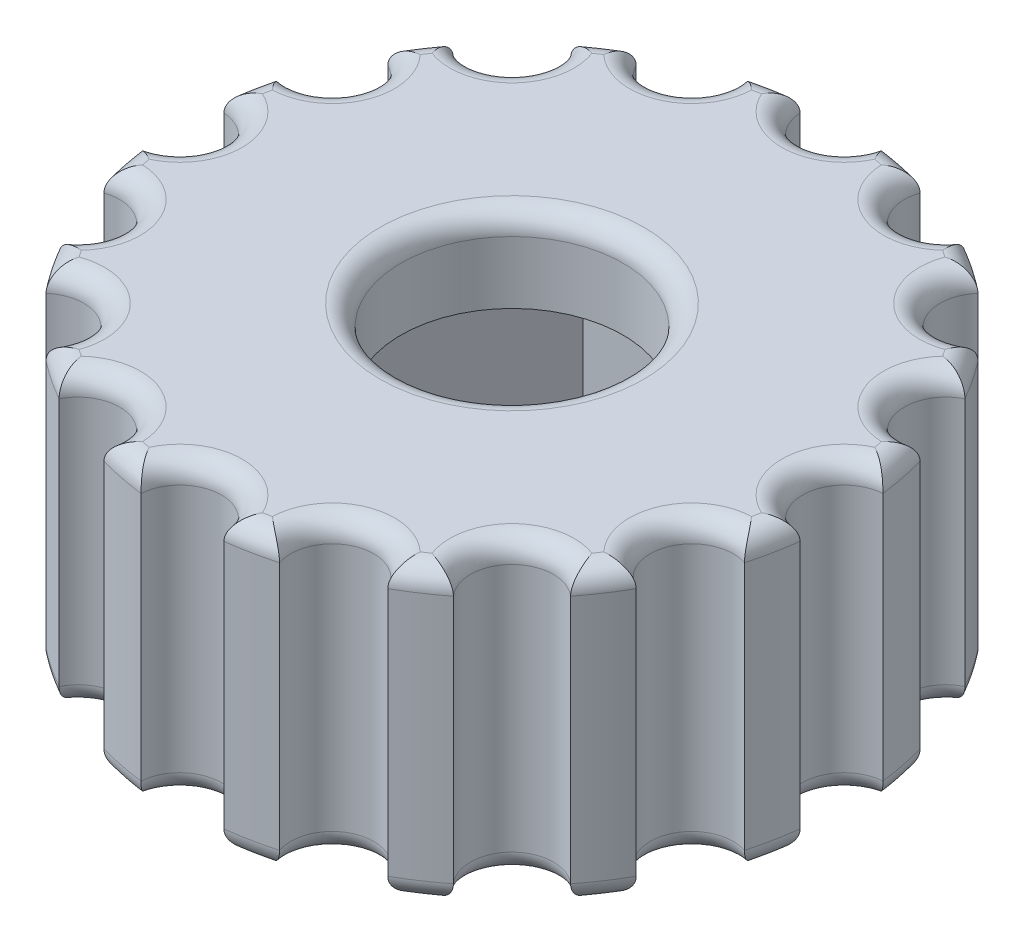
from build123d import *

# Parameters (mm, degrees)
SKETCH2_R               = 8
BOSS_EXTRUDE1_DEPTH     = 3.5
SKETCH3_R               = 8
BOSS_EXTRUDE2_DEPTH     = 2
CUT_EXTRUDE1_DEPTH      = 13.369316877
CUT_EXTRUDE1_DEPTH_BACK = 13.369316877
SKETCH4_R               = 2.675
CUT_EXTRUDE2_DEPTH      = 14.304134696
CUT_EXTRUDE2_DEPTH_BACK = 14.304134696
SKETCH5_R               = 1
FILLET1_R               = 0.5


with BuildPart() as part:
    # Sketch2 → Boss-Extrude1 (new, symmetric)
    with BuildSketch(Plane(origin=(0, 0, 0), x_dir=(1, 0, 0), z_dir=(0, 1, 0))):
        with Locations(Location((0, 0, 0), (0, 0, 270))):
            Circle(SKETCH2_R)
        Polygon((-2.3375, 4.048668763), (-4.675, 0), (-2.3375, -4.048668763), (2.3375, -4.048668763), (4.675, 0), (2.3375, 4.048668763), align=None, mode=Mode.SUBTRACT)
    extrude(amount=BOSS_EXTRUDE1_DEPTH, both=True)

    # Sketch3 → Boss-Extrude2 (add)
    with BuildSketch(Plane(origin=(0, 3.5, 0), x_dir=(1, 0, 0), z_dir=(0, 1, 0))):
        with Locations(Location((0, 0, 0), (0, 0, 270))):
            Circle(SKETCH3_R)
    extrude(amount=-BOSS_EXTRUDE2_DEPTH)

    # Sketch4 → Cut-Extrude1 (cut, two sides: drawn at the far end of the back side and taken through both)
    with BuildSketch(Plane.XZ.offset(-1.5).offset(-CUT_EXTRUDE1_DEPTH_BACK)):
        with Locations(Location((0, 0, 0), (0, 0, 270))):
            Circle(SKETCH4_R)
    extrude(amount=CUT_EXTRUDE1_DEPTH + CUT_EXTRUDE1_DEPTH_BACK, mode=Mode.SUBTRACT)

    # Sketch5 → Cut-Extrude2 (cut, two sides: drawn at the far end of the back side and taken through both)
    with BuildSketch(Plane.XZ.offset(3.5).offset(-CUT_EXTRUDE2_DEPTH_BACK)):
        with Locations((0, 8)):
            Circle(SKETCH5_R)
        with Locations((3.061467459, 7.39103626)):
            Circle(SKETCH5_R)
        with Locations((5.656854249, 5.656854249)):
            Circle(SKETCH5_R)
        with Locations((7.39103626, 3.061467459)):
            Circle(SKETCH5_R)
        with Locations((8, 0)):
            Circle(SKETCH5_R)
        with Locations((7.39103626, -3.061467459)):
            Circle(SKETCH5_R)
        with Locations((5.656854249, -5.656854249)):
            Circle(SKETCH5_R)
        with Locations((3.061467459, -7.39103626)):
            Circle(SKETCH5_R)
        with Locations((0, -8)):
            Circle(SKETCH5_R)
        with Locations((-3.061467459, -7.39103626)):
            Circle(SKETCH5_R)
        with Locations((-5.656854249, -5.656854249)):
            Circle(SKETCH5_R)
        with Locations((-7.39103626, -3.061467459)):
            Circle(SKETCH5_R)
        with Locations((-8, 0)):
            Circle(SKETCH5_R)
        with Locations((-7.39103626, 3.061467459)):
            Circle(SKETCH5_R)
        with Locations((-5.656854249, 5.656854249)):
            Circle(SKETCH5_R)
        with Locations((-3.061467459, 7.39103626)):
            Circle(SKETCH5_R)
    extrude(amount=CUT_EXTRUDE2_DEPTH + CUT_EXTRUDE2_DEPTH_BACK, mode=Mode.SUBTRACT)

    # Fillet1
    fillet1_edges = [part.edges().sort_by_distance(p)[0] for p in [
        (-3.50625, -3.5, 2.024334381),
        (0, -3.5, 4.048668763),
        (-2.678784027, -3.5, 6.467156728),
        (-2.678784027, 3.5, 6.467156728),
        (3.50625, -3.5, 2.024334381),
        (-4.949747468, -3.5, 4.949747468),
        (-4.949747468, 3.5, 4.949747468),
        (-6.467156728, -3.5, 2.678784027),
        (-6.467156728, 3.5, 2.678784027),
        (3.50625, -3.5, -2.024334381),
        (-7, -3.5, 0),
        (-7, 3.5, 0),
        (-6.467156728, -3.5, -2.678784027),
        (-6.467156728, 3.5, -2.678784027),
        (-4.949747468, -3.5, -4.949747468),
        (-4.949747468, 3.5, -4.949747468),
        (-2.678784027, -3.5, -6.467156728),
        (-2.678784027, 3.5, -6.467156728),
        (0, -3.5, -7),
        (0, 3.5, -7),
        (2.678784027, -3.5, -6.467156728),
        (2.678784027, 3.5, -6.467156728),
        (4.949747468, -3.5, -4.949747468),
        (4.949747468, 3.5, -4.949747468),
        (6.467156728, -3.5, -2.678784027),
        (6.467156728, 3.5, -2.678784027),
        (7, -3.5, 0),
        (7, 3.5, 0),
        (6.467156728, -3.5, 2.678784027),
        (6.467156728, 3.5, 2.678784027),
        (4.949747468, -3.5, 4.949747468),
        (4.949747468, 3.5, 4.949747468),
        (2.678784027, -3.5, 6.467156728),
        (2.678784027, 3.5, 6.467156728),
        (0, -3.5, 7),
        (0, 3.5, 7),
        (1.560722576, -3.5, 7.846282243),
        (0, 3.5, 2.675),
        (1.560722576, 3.5, 7.846282243),
        (4.444561864, 3.5, 6.651756898),
        (6.651756898, 3.5, 4.444561864),
        (7.846282243, 3.5, 1.560722576),
        (7.846282243, 3.5, -1.560722576),
        (6.651756898, 3.5, -4.444561864),
        (4.444561864, 3.5, -6.651756898),
        (1.560722576, 3.5, -7.846282243),
        (-1.560722576, 3.5, -7.846282243),
        (-4.444561864, 3.5, -6.651756898),
        (-6.651756898, 3.5, -4.444561864),
        (-7.846282243, 3.5, -1.560722576),
        (-7.846282243, 3.5, 1.560722576),
        (-6.651756898, 3.5, 4.444561864),
        (-4.444561864, 3.5, 6.651756898),
        (-1.560722576, 3.5, 7.846282243),
        (4.444561864, -3.5, 6.651756898),
        (6.651756898, -3.5, 4.444561864),
        (7.846282243, -3.5, 1.560722576),
        (7.846282243, -3.5, -1.560722576),
        (6.651756898, -3.5, -4.444561864),
        (4.444561864, -3.5, -6.651756898),
        (1.560722576, -3.5, -7.846282243),
        (-1.560722576, -3.5, -7.846282243),
        (-4.444561864, -3.5, -6.651756898),
        (-6.651756898, -3.5, -4.444561864),
        (-7.846282243, -3.5, -1.560722576),
        (-7.846282243, -3.5, 1.560722576),
        (-6.651756898, -3.5, 4.444561864),
        (-4.444561864, -3.5, 6.651756898),
        (-1.560722576, -3.5, 7.846282243),
        (0, -3.5, -4.048668763),
        (-3.50625, -3.5, -2.024334381),
    ]]
    fillet(fillet1_edges, radius=FILLET1_R)


solid = part.part
